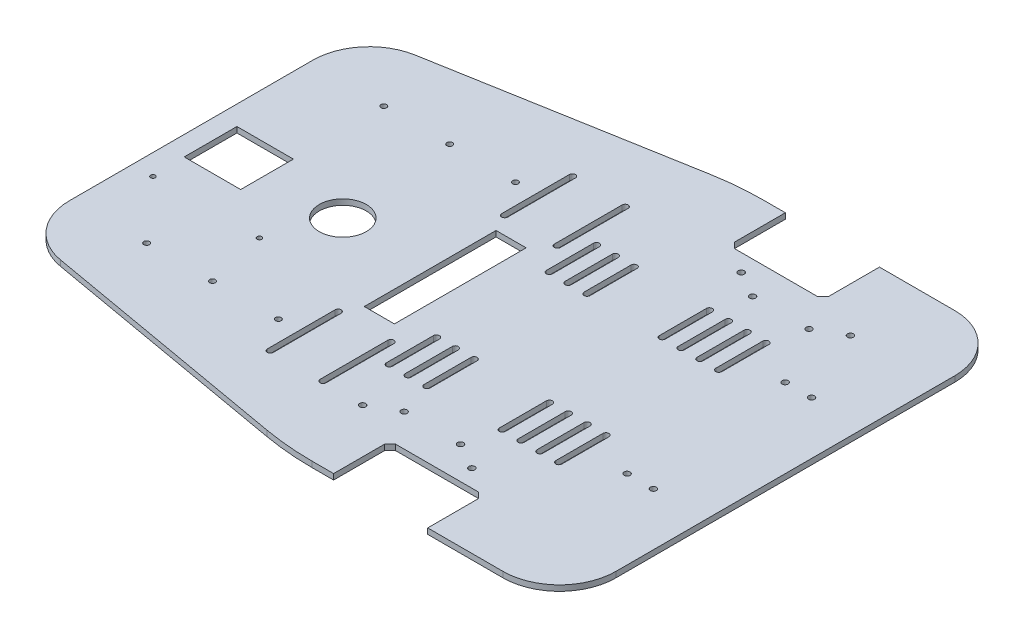
from build123d import *

# Parameters (mm, degrees)
EXTRUDE_1_DEPTH      = 3
SKETCH_2_W           = 50
SKETCH_2_H           = 30
CUT_EXTRUDE_1_DEPTH  = 201.022498735
CHAMFER_1_SIZE       = 3
SKETCH_3_R           = 1.6
CUT_EXTRUDE_2_DEPTH  = 201.022498735
FILLET_3_R           = 150
CUT_EXTRUDE_3_REACH  = 202.022
SKETCH_6_R           = 1.6
CUT_EXTRUDE_5_REACH  = 202.022
SKETCH_8_R           = 1.5
CUT_EXTRUDE_11_REACH = 202.022
CUT_EXTRUDE_12_REACH = 202.022
SKETCH_12_R          = 12.5
SKETCH_12_W          = 16
SKETCH_12_H          = 70
CUT_EXTRUDE_13_REACH = 202.022
SKETCH_13_W          = 30
SKETCH_13_H          = 28
SKETCH_15_R          = 1.25
CUT_EXTRUDE_16_DEPTH = 8
CUT_EXTRUDE_17_DEPTH = 10


with BuildPart() as part:
    # 草图1 → 凸台-拉伸1 (new body)
    with BuildSketch(Plane(origin=(0, 0, 0), x_dir=(1, 0, 0), z_dir=(0, 1, 0))):
        with BuildLine():
            Line((15.305141195, 120), (130, 120))
            ThreePointArc((130, 120), (151.213203436, 111.213203436), (160, 90))
            Line((160, 90), (160, -90))
            ThreePointArc((160, -90), (151.213203436, -111.213203436), (130, -120))
            Line((130, -120), (15.305141195, -120))
            Line((15.305141195, -120), (-130.923883529, -94.215877579))
            ThreePointArc((-130.923883529, -94.215877579), (-148.695771492, -83.955273279), (-155.714438199, -64.671644988))
            Line((-155.714438199, -64.671644988), (-155.714438199, 64.671644988))
            ThreePointArc((-155.714438199, 64.671644988), (-148.695771492, 83.955273279), (-130.923883529, 94.215877579))
            Line((-130.923883529, 94.215877579), (15.305141195, 120))
        make_face()
    extrude(amount=EXTRUDE_1_DEPTH)

    # 草图2 → 切除-拉伸1 (cut, through all)
    with BuildSketch(Plane(origin=(0, 3, 0), x_dir=(1, 0, 0), z_dir=(0, 1, 0))):
        with Locations((65, -105)):
            Rectangle(SKETCH_2_W, SKETCH_2_H)
        with Locations((65, 105)):
            Rectangle(SKETCH_2_W, SKETCH_2_H)
    extrude(amount=-CUT_EXTRUDE_1_DEPTH, mode=Mode.SUBTRACT)

    # 倒角1
    chamfer_1_edges = [part.edges().sort_by_distance(p)[0] for p in [
        (40, 1.5, 90),
        (90, 1.5, 90),
        (40, 1.5, -90),
        (90, 1.5, -90),
    ]]
    chamfer(chamfer_1_edges, length=CHAMFER_1_SIZE)

    # 草图3 → 切除-拉伸2 (cut, through all)
    with BuildSketch(Plane(origin=(0, 3, 0), x_dir=(1, 0, 0), z_dir=(0, 1, 0))):
        with Locations(Location((74.23, -80.8, 0), (0, 0, 270))):
            Circle(SKETCH_3_R)
        with Locations(Location((60.23, -72.8, 0), (0, 0, 270))):
            Circle(SKETCH_3_R)
        with Locations(Location((16.23, -80.8, 0), (0, 0, 90))):
            Circle(SKETCH_3_R)
        with Locations(Location((30.23, -72.8, 0), (0, 0, 90))):
            Circle(SKETCH_3_R)
        with Locations(Location((55.77, 80.8, 0), (0, 0, 270))):
            Circle(SKETCH_3_R)
        with Locations(Location((69.77, 72.8, 0), (0, 0, 270))):
            Circle(SKETCH_3_R)
        with Locations(Location((99.77, 72.8, 0), (0, 0, 90))):
            Circle(SKETCH_3_R)
        with Locations(Location((113.77, 80.8, 0), (0, 0, 90))):
            Circle(SKETCH_3_R)
    extrude(amount=-CUT_EXTRUDE_2_DEPTH, mode=Mode.SUBTRACT)

    # 圆角3
    fillet_3_edges = [part.edges().sort_by_distance(p)[0] for p in [
        (15.305141195, 1.5, 120),
        (15.305141195, 1.5, -120),
    ]]
    fillet(fillet_3_edges, radius=FILLET_3_R)

    # 草图6 → 切除-拉伸3 (cut, up to next)
    with BuildSketch(Plane(origin=(0, 3, 0), x_dir=(1, 0, 0), z_dir=(0, 1, 0)), mode=Mode.PRIVATE) as cut_extrude_3_sk1:
        with Locations(Location((132, 41.909918854, 0), (0, 0, 270))):
            Circle(SKETCH_6_R)
    cut_extrude_3_tool1 = extrude(cut_extrude_3_sk1.sketch, amount=-CUT_EXTRUDE_3_REACH, mode=Mode.PRIVATE) & part.part
    # 草图6 → 切除-拉伸3 (cut, up to next)
    with BuildSketch(Plane(origin=(0, 3, 0), x_dir=(1, 0, 0), z_dir=(0, 1, 0)), mode=Mode.PRIVATE) as cut_extrude_3_sk2:
        with Locations(Location((118, 41.909918854, 0), (0, 0, 270))):
            Circle(SKETCH_6_R)
    cut_extrude_3_tool2 = extrude(cut_extrude_3_sk2.sketch, amount=-CUT_EXTRUDE_3_REACH, mode=Mode.PRIVATE) & part.part
    # 草图6 → 切除-拉伸3 (cut, up to next)
    with BuildSketch(Plane(origin=(0, 3, 0), x_dir=(1, 0, 0), z_dir=(0, 1, 0)), mode=Mode.PRIVATE) as cut_extrude_3_sk3:
        with Locations(Location((132, -42.090081146, 0), (0, 0, 270))):
            Circle(SKETCH_6_R)
    cut_extrude_3_tool3 = extrude(cut_extrude_3_sk3.sketch, amount=-CUT_EXTRUDE_3_REACH, mode=Mode.PRIVATE) & part.part
    # 草图6 → 切除-拉伸3 (cut, up to next)
    with BuildSketch(Plane(origin=(0, 3, 0), x_dir=(1, 0, 0), z_dir=(0, 1, 0)), mode=Mode.PRIVATE) as cut_extrude_3_sk4:
        with Locations(Location((118, -42.090081146, 0), (0, 0, 270))):
            Circle(SKETCH_6_R)
    cut_extrude_3_tool4 = extrude(cut_extrude_3_sk4.sketch, amount=-CUT_EXTRUDE_3_REACH, mode=Mode.PRIVATE) & part.part
    add(cut_extrude_3_tool1.solids().sort_by_distance((132, 3, -41.909919))[0], mode=Mode.SUBTRACT)
    add(cut_extrude_3_tool2.solids().sort_by_distance((118, 3, -41.909919))[0], mode=Mode.SUBTRACT)
    add(cut_extrude_3_tool3.solids().sort_by_distance((132, 3, 42.090081))[0], mode=Mode.SUBTRACT)
    add(cut_extrude_3_tool4.solids().sort_by_distance((118, 3, 42.090081))[0], mode=Mode.SUBTRACT)

    # 草图8 → 切除-拉伸5 (cut, up to next)
    with BuildSketch(Plane.XZ, mode=Mode.PRIVATE) as cut_extrude_5_sk1:
        with Locations(Location((-115.714438199, -62.380961246, 0), (0, 0, 270))):
            Circle(SKETCH_8_R)
    cut_extrude_5_tool1 = extrude(cut_extrude_5_sk1.sketch, amount=-CUT_EXTRUDE_5_REACH, mode=Mode.PRIVATE) & part.part
    # 草图8 → 切除-拉伸5 (cut, up to next)
    with BuildSketch(Plane.XZ, mode=Mode.PRIVATE) as cut_extrude_5_sk2:
        with Locations(Location((-80.714438199, -62.380961246, 0), (0, 0, 270))):
            Circle(SKETCH_8_R)
    cut_extrude_5_tool2 = extrude(cut_extrude_5_sk2.sketch, amount=-CUT_EXTRUDE_5_REACH, mode=Mode.PRIVATE) & part.part
    # 草图8 → 切除-拉伸5 (cut, up to next)
    with BuildSketch(Plane.XZ, mode=Mode.PRIVATE) as cut_extrude_5_sk3:
        with Locations(Location((-45.714438199, -62.380961246, 0), (0, 0, 270))):
            Circle(SKETCH_8_R)
    cut_extrude_5_tool3 = extrude(cut_extrude_5_sk3.sketch, amount=-CUT_EXTRUDE_5_REACH, mode=Mode.PRIVATE) & part.part
    # 草图8 → 切除-拉伸5 (cut, up to next)
    with BuildSketch(Plane.XZ, mode=Mode.PRIVATE) as cut_extrude_5_sk4:
        with Locations(Location((-45.714438199, 63.619038754, 0), (0, 0, 270))):
            Circle(SKETCH_8_R)
    cut_extrude_5_tool4 = extrude(cut_extrude_5_sk4.sketch, amount=-CUT_EXTRUDE_5_REACH, mode=Mode.PRIVATE) & part.part
    # 草图8 → 切除-拉伸5 (cut, up to next)
    with BuildSketch(Plane.XZ, mode=Mode.PRIVATE) as cut_extrude_5_sk5:
        with Locations(Location((-80.714438199, 63.619038754, 0), (0, 0, 270))):
            Circle(SKETCH_8_R)
    cut_extrude_5_tool5 = extrude(cut_extrude_5_sk5.sketch, amount=-CUT_EXTRUDE_5_REACH, mode=Mode.PRIVATE) & part.part
    # 草图8 → 切除-拉伸5 (cut, up to next)
    with BuildSketch(Plane.XZ, mode=Mode.PRIVATE) as cut_extrude_5_sk6:
        with Locations(Location((-115.714438199, 63.619038754, 0), (0, 0, 270))):
            Circle(SKETCH_8_R)
    cut_extrude_5_tool6 = extrude(cut_extrude_5_sk6.sketch, amount=-CUT_EXTRUDE_5_REACH, mode=Mode.PRIVATE) & part.part
    add(cut_extrude_5_tool1.solids().sort_by_distance((-115.714438, 0, -62.380961))[0], mode=Mode.SUBTRACT)
    add(cut_extrude_5_tool2.solids().sort_by_distance((-80.714438, 0, -62.380961))[0], mode=Mode.SUBTRACT)
    add(cut_extrude_5_tool3.solids().sort_by_distance((-45.714438, 0, -62.380961))[0], mode=Mode.SUBTRACT)
    add(cut_extrude_5_tool4.solids().sort_by_distance((-45.714438, 0, 63.619039))[0], mode=Mode.SUBTRACT)
    add(cut_extrude_5_tool5.solids().sort_by_distance((-80.714438, 0, 63.619039))[0], mode=Mode.SUBTRACT)
    add(cut_extrude_5_tool6.solids().sort_by_distance((-115.714438, 0, 63.619039))[0], mode=Mode.SUBTRACT)

    # 草图11 → 切除-拉伸11 (cut, up to next)
    with BuildSketch(Plane.XZ, mode=Mode.PRIVATE) as cut_extrude_11_sk1:
        with BuildLine():
            Line((86.246631186, 55), (86.246631186, 30))
            ThreePointArc((86.246631186, 30), (84.646631186, 28.4), (83.046631186, 30))
            Line((83.046631186, 30), (83.046631186, 55))
            ThreePointArc((83.046631186, 55), (84.646631186, 56.6), (86.246631186, 55))
        make_face()
    cut_extrude_11_tool1 = extrude(cut_extrude_11_sk1.sketch, amount=-CUT_EXTRUDE_11_REACH, mode=Mode.PRIVATE) & part.part
    # 草图11 → 切除-拉伸11 (cut, up to next)
    with BuildSketch(Plane.XZ, mode=Mode.PRIVATE) as cut_extrude_11_sk2:
        with BuildLine():
            Line((76.246631186, 55), (76.246631186, 30))
            ThreePointArc((76.246631186, 30), (74.646631186, 28.4), (73.046631186, 30))
            Line((73.046631186, 30), (73.046631186, 55))
            ThreePointArc((73.046631186, 55), (74.646631186, 56.6), (76.246631186, 55))
        make_face()
    cut_extrude_11_tool2 = extrude(cut_extrude_11_sk2.sketch, amount=-CUT_EXTRUDE_11_REACH, mode=Mode.PRIVATE) & part.part
    # 草图11 → 切除-拉伸11 (cut, up to next)
    with BuildSketch(Plane.XZ, mode=Mode.PRIVATE) as cut_extrude_11_sk3:
        with BuildLine():
            Line((66.246631186, 55), (66.246631186, 30))
            ThreePointArc((66.246631186, 30), (64.646631186, 28.4), (63.046631186, 30))
            Line((63.046631186, 30), (63.046631186, 55))
            ThreePointArc((63.046631186, 55), (64.646631186, 56.6), (66.246631186, 55))
        make_face()
    cut_extrude_11_tool3 = extrude(cut_extrude_11_sk3.sketch, amount=-CUT_EXTRUDE_11_REACH, mode=Mode.PRIVATE) & part.part
    # 草图11 → 切除-拉伸11 (cut, up to next)
    with BuildSketch(Plane.XZ, mode=Mode.PRIVATE) as cut_extrude_11_sk4:
        with BuildLine():
            Line((3.046631186, 55), (3.046631186, 30))
            ThreePointArc((3.046631186, 30), (4.646631186, 28.4), (6.246631186, 30))
            Line((6.246631186, 30), (6.246631186, 55))
            ThreePointArc((6.246631186, 55), (4.646631186, 56.6), (3.046631186, 55))
        make_face()
    cut_extrude_11_tool4 = extrude(cut_extrude_11_sk4.sketch, amount=-CUT_EXTRUDE_11_REACH, mode=Mode.PRIVATE) & part.part
    # 草图11 → 切除-拉伸11 (cut, up to next)
    with BuildSketch(Plane.XZ, mode=Mode.PRIVATE) as cut_extrude_11_sk5:
        with BuildLine():
            Line((13.046631186, 55), (13.046631186, 30))
            ThreePointArc((13.046631186, 30), (14.646631186, 28.4), (16.246631186, 30))
            Line((16.246631186, 30), (16.246631186, 55))
            ThreePointArc((16.246631186, 55), (14.646631186, 56.6), (13.046631186, 55))
        make_face()
    cut_extrude_11_tool5 = extrude(cut_extrude_11_sk5.sketch, amount=-CUT_EXTRUDE_11_REACH, mode=Mode.PRIVATE) & part.part
    # 草图11 → 切除-拉伸11 (cut, up to next)
    with BuildSketch(Plane.XZ, mode=Mode.PRIVATE) as cut_extrude_11_sk6:
        with BuildLine():
            Line((23.046631186, 55), (23.046631186, 30))
            ThreePointArc((23.046631186, 30), (24.646631186, 28.4), (26.246631186, 30))
            Line((26.246631186, 30), (26.246631186, 55))
            ThreePointArc((26.246631186, 55), (24.646631186, 56.6), (23.046631186, 55))
        make_face()
    cut_extrude_11_tool6 = extrude(cut_extrude_11_sk6.sketch, amount=-CUT_EXTRUDE_11_REACH, mode=Mode.PRIVATE) & part.part
    # 草图11 → 切除-拉伸11 (cut, up to next)
    with BuildSketch(Plane.XZ, mode=Mode.PRIVATE) as cut_extrude_11_sk7:
        with BuildLine():
            Line((3.046631186, -55), (3.046631186, -30))
            ThreePointArc((3.046631186, -30), (4.646631186, -28.4), (6.246631186, -30))
            Line((6.246631186, -30), (6.246631186, -55))
            ThreePointArc((6.246631186, -55), (4.646631186, -56.6), (3.046631186, -55))
        make_face()
    cut_extrude_11_tool7 = extrude(cut_extrude_11_sk7.sketch, amount=-CUT_EXTRUDE_11_REACH, mode=Mode.PRIVATE) & part.part
    # 草图11 → 切除-拉伸11 (cut, up to next)
    with BuildSketch(Plane.XZ, mode=Mode.PRIVATE) as cut_extrude_11_sk8:
        with BuildLine():
            Line((13.046631186, -55), (13.046631186, -30))
            ThreePointArc((13.046631186, -30), (14.646631186, -28.4), (16.246631186, -30))
            Line((16.246631186, -30), (16.246631186, -55))
            ThreePointArc((16.246631186, -55), (14.646631186, -56.6), (13.046631186, -55))
        make_face()
    cut_extrude_11_tool8 = extrude(cut_extrude_11_sk8.sketch, amount=-CUT_EXTRUDE_11_REACH, mode=Mode.PRIVATE) & part.part
    # 草图11 → 切除-拉伸11 (cut, up to next)
    with BuildSketch(Plane.XZ, mode=Mode.PRIVATE) as cut_extrude_11_sk9:
        with BuildLine():
            Line((23.046631186, -55), (23.046631186, -30))
            ThreePointArc((23.046631186, -30), (24.646631186, -28.4), (26.246631186, -30))
            Line((26.246631186, -30), (26.246631186, -55))
            ThreePointArc((26.246631186, -55), (24.646631186, -56.6), (23.046631186, -55))
        make_face()
    cut_extrude_11_tool9 = extrude(cut_extrude_11_sk9.sketch, amount=-CUT_EXTRUDE_11_REACH, mode=Mode.PRIVATE) & part.part
    # 草图11 → 切除-拉伸11 (cut, up to next)
    with BuildSketch(Plane.XZ, mode=Mode.PRIVATE) as cut_extrude_11_sk10:
        with BuildLine():
            Line((86.246631186, -55), (86.246631186, -30))
            ThreePointArc((86.246631186, -30), (84.646631186, -28.4), (83.046631186, -30))
            Line((83.046631186, -30), (83.046631186, -55))
            ThreePointArc((83.046631186, -55), (84.646631186, -56.6), (86.246631186, -55))
        make_face()
    cut_extrude_11_tool10 = extrude(cut_extrude_11_sk10.sketch, amount=-CUT_EXTRUDE_11_REACH, mode=Mode.PRIVATE) & part.part
    # 草图11 → 切除-拉伸11 (cut, up to next)
    with BuildSketch(Plane.XZ, mode=Mode.PRIVATE) as cut_extrude_11_sk11:
        with BuildLine():
            Line((76.246631186, -55), (76.246631186, -30))
            ThreePointArc((76.246631186, -30), (74.646631186, -28.4), (73.046631186, -30))
            Line((73.046631186, -30), (73.046631186, -55))
            ThreePointArc((73.046631186, -55), (74.646631186, -56.6), (76.246631186, -55))
        make_face()
    cut_extrude_11_tool11 = extrude(cut_extrude_11_sk11.sketch, amount=-CUT_EXTRUDE_11_REACH, mode=Mode.PRIVATE) & part.part
    # 草图11 → 切除-拉伸11 (cut, up to next)
    with BuildSketch(Plane.XZ, mode=Mode.PRIVATE) as cut_extrude_11_sk12:
        with BuildLine():
            Line((66.246631186, -55), (66.246631186, -30))
            ThreePointArc((66.246631186, -30), (64.646631186, -28.4), (63.046631186, -30))
            Line((63.046631186, -30), (63.046631186, -55))
            ThreePointArc((63.046631186, -55), (64.646631186, -56.6), (66.246631186, -55))
        make_face()
    cut_extrude_11_tool12 = extrude(cut_extrude_11_sk12.sketch, amount=-CUT_EXTRUDE_11_REACH, mode=Mode.PRIVATE) & part.part
    # 草图11 → 切除-拉伸11 (cut, up to next)
    with BuildSketch(Plane.XZ, mode=Mode.PRIVATE) as cut_extrude_11_sk13:
        with BuildLine():
            Line((96.246631186, 55), (96.246631186, 30))
            ThreePointArc((96.246631186, 30), (94.646631186, 28.4), (93.046631186, 30))
            Line((93.046631186, 30), (93.046631186, 55))
            ThreePointArc((93.046631186, 55), (94.646631186, 56.6), (96.246631186, 55))
        make_face()
    cut_extrude_11_tool13 = extrude(cut_extrude_11_sk13.sketch, amount=-CUT_EXTRUDE_11_REACH, mode=Mode.PRIVATE) & part.part
    # 草图11 → 切除-拉伸11 (cut, up to next)
    with BuildSketch(Plane.XZ, mode=Mode.PRIVATE) as cut_extrude_11_sk14:
        with BuildLine():
            Line((96.246631186, -55), (96.246631186, -30))
            ThreePointArc((96.246631186, -30), (94.646631186, -28.4), (93.046631186, -30))
            Line((93.046631186, -30), (93.046631186, -55))
            ThreePointArc((93.046631186, -55), (94.646631186, -56.6), (96.246631186, -55))
        make_face()
    cut_extrude_11_tool14 = extrude(cut_extrude_11_sk14.sketch, amount=-CUT_EXTRUDE_11_REACH, mode=Mode.PRIVATE) & part.part
    add(cut_extrude_11_tool1.solids().sort_by_distance((84.646631, 0, 42.5))[0], mode=Mode.SUBTRACT)
    add(cut_extrude_11_tool2.solids().sort_by_distance((74.646631, 0, 42.5))[0], mode=Mode.SUBTRACT)
    add(cut_extrude_11_tool3.solids().sort_by_distance((64.646631, 0, 42.5))[0], mode=Mode.SUBTRACT)
    add(cut_extrude_11_tool4.solids().sort_by_distance((4.646631, 0, 42.5))[0], mode=Mode.SUBTRACT)
    add(cut_extrude_11_tool5.solids().sort_by_distance((14.646631, 0, 42.5))[0], mode=Mode.SUBTRACT)
    add(cut_extrude_11_tool6.solids().sort_by_distance((24.646631, 0, 42.5))[0], mode=Mode.SUBTRACT)
    add(cut_extrude_11_tool7.solids().sort_by_distance((4.646631, 0, -42.5))[0], mode=Mode.SUBTRACT)
    add(cut_extrude_11_tool8.solids().sort_by_distance((14.646631, 0, -42.5))[0], mode=Mode.SUBTRACT)
    add(cut_extrude_11_tool9.solids().sort_by_distance((24.646631, 0, -42.5))[0], mode=Mode.SUBTRACT)
    add(cut_extrude_11_tool10.solids().sort_by_distance((84.646631, 0, -42.5))[0], mode=Mode.SUBTRACT)
    add(cut_extrude_11_tool11.solids().sort_by_distance((74.646631, 0, -42.5))[0], mode=Mode.SUBTRACT)
    add(cut_extrude_11_tool12.solids().sort_by_distance((64.646631, 0, -42.5))[0], mode=Mode.SUBTRACT)
    add(cut_extrude_11_tool13.solids().sort_by_distance((94.646631, 0, 42.5))[0], mode=Mode.SUBTRACT)
    add(cut_extrude_11_tool14.solids().sort_by_distance((94.646631, 0, -42.5))[0], mode=Mode.SUBTRACT)

    # 草图12 → 切除-拉伸12 (cut, up to next)
    with BuildSketch(Plane.XZ, mode=Mode.PRIVATE) as cut_extrude_12_sk1:
        with Locations(Location((-75.123446108, 0, 0), (0, 0, 270))):
            Circle(SKETCH_12_R)
    cut_extrude_12_tool1 = extrude(cut_extrude_12_sk1.sketch, amount=-CUT_EXTRUDE_12_REACH, mode=Mode.PRIVATE) & part.part
    # 草图12 → 切除-拉伸12 (cut, up to next)
    with BuildSketch(Plane.XZ, mode=Mode.PRIVATE) as cut_extrude_12_sk2:
        with Locations((-20.704142093, 0)):
            Rectangle(SKETCH_12_W, SKETCH_12_H)
    cut_extrude_12_tool2 = extrude(cut_extrude_12_sk2.sketch, amount=-CUT_EXTRUDE_12_REACH, mode=Mode.PRIVATE) & part.part
    add(cut_extrude_12_tool1.solids().sort_by_distance((-75.123446, 0, 0))[0], mode=Mode.SUBTRACT)
    add(cut_extrude_12_tool2.solids().sort_by_distance((-20.704142, 0, 0))[0], mode=Mode.SUBTRACT)

    # 草图13 → 切除-拉伸13 (cut, up to next)
    with BuildSketch(Plane(origin=(0, 3, 0), x_dir=(1, 0, 0), z_dir=(0, 1, 0)), mode=Mode.PRIVATE) as cut_extrude_13_sk1:
        with Locations((-130.364438199, 0)):
            Rectangle(SKETCH_13_W, SKETCH_13_H)
    cut_extrude_13_tool1 = extrude(cut_extrude_13_sk1.sketch, amount=-CUT_EXTRUDE_13_REACH, mode=Mode.PRIVATE) & part.part
    add(cut_extrude_13_tool1.solids().sort_by_distance((-130.364438, 3, 0))[0], mode=Mode.SUBTRACT)

    # 草图15 → 切除-拉伸16 (cut)
    with BuildSketch(Plane(origin=(0, 3, 0), x_dir=(1, 0, 0), z_dir=(0, 1, 0))):
        with Locations(Location((-144.714438199, -31.3, 0), (0, 0, 270))):
            Circle(SKETCH_15_R)
        with Locations(Location((-88.114438199, -31.3, 0), (0, 0, 270))):
            Circle(SKETCH_15_R)
    extrude(amount=-CUT_EXTRUDE_16_DEPTH, mode=Mode.SUBTRACT)

    # 草图19 → 切除-拉伸17 (cut)
    with BuildSketch(Plane(origin=(0, 3, 0), x_dir=(1, 0, 0), z_dir=(0, 1, 0))):
        with BuildLine():
            Line((-31.757414193, -44.240106193), (-31.757414193, -80.240106193))
            ThreePointArc((-31.757414193, -80.240106193), (-33.357414193, -81.840106193), (-34.957414193, -80.240106193))
            Line((-34.957414193, -80.240106193), (-34.957414193, -44.240106193))
            ThreePointArc((-34.957414193, -44.240106193), (-33.357414193, -42.640106193), (-31.757414193, -44.240106193))
        make_face()
        with BuildLine():
            Line((-6.957414193, -44.240106193), (-6.957414193, -80.240106193))
            ThreePointArc((-6.957414193, -80.240106193), (-5.357414193, -81.840106193), (-3.757414193, -80.240106193))
            Line((-3.757414193, -80.240106193), (-3.757414193, -44.240106193))
            ThreePointArc((-3.757414193, -44.240106193), (-5.357414193, -42.640106193), (-6.957414193, -44.240106193))
        make_face()
    cut_extrude_17 = extrude(amount=-CUT_EXTRUDE_17_DEPTH, mode=Mode.SUBTRACT)

    # 镜向1: 切除-拉伸17 across plane
    add(cut_extrude_17.mirror(Plane.XY), mode=Mode.SUBTRACT)


solid = part.part
